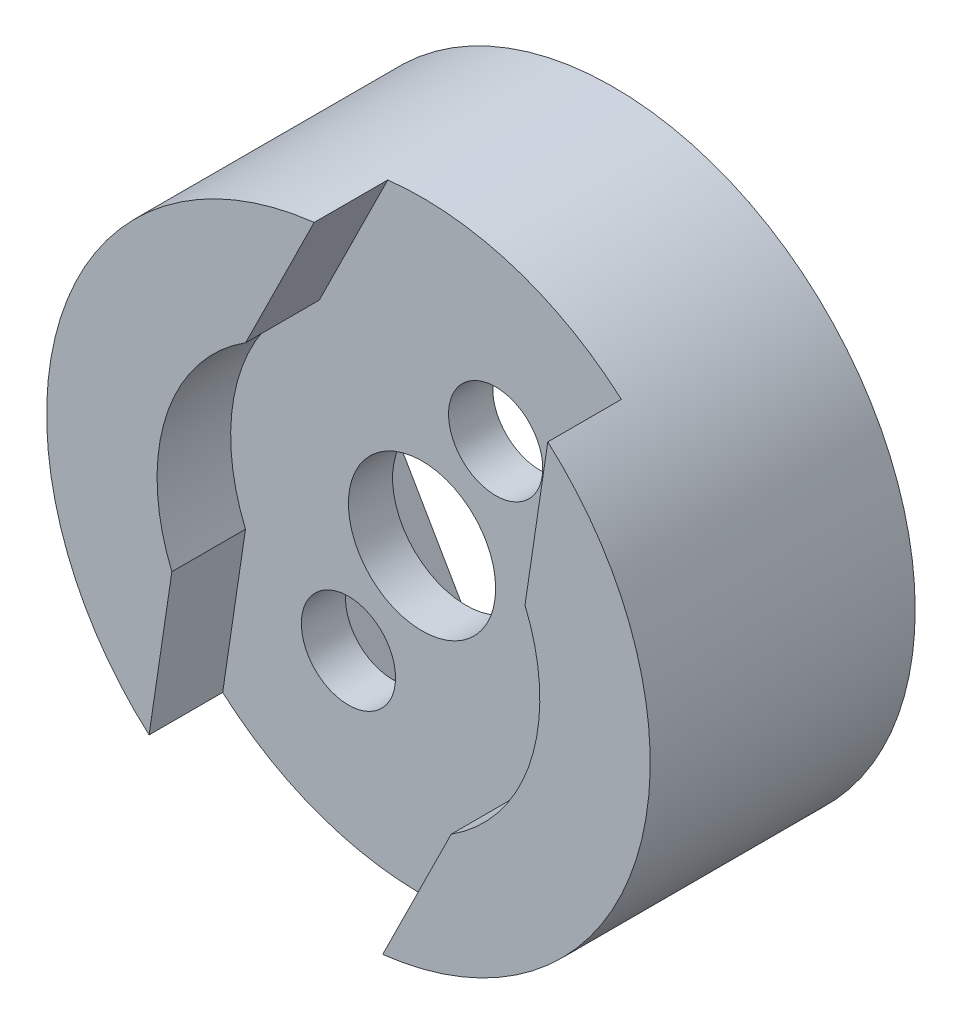
from build123d import *

# Parameters (mm, degrees)
SKETCH1_R               = 10.25
BOSS_EXTRUDE1_DEPTH     = 5
SKETCH2_R               = 10.25
BOSS_EXTRUDE2_DEPTH     = 4
CUT_EXTRUDE1_DEPTH      = 18.062385531
CUT_EXTRUDE1_DEPTH_BACK = 2.5
CUT_EXTRUDE2_DEPTH      = 16.333786225
CUT_EXTRUDE2_DEPTH_BACK = 16.333786225
SKETCH4_R               = 1.6
CUT_EXTRUDE3_DEPTH      = 16.333786225
CUT_EXTRUDE3_DEPTH_BACK = 16.333786225
SKETCH5_R               = 2.5


with BuildPart() as part:
    # Sketch1 → Boss-Extrude1 (new body)
    with BuildSketch(Plane.XY):
        Circle(SKETCH1_R)
        Polygon((4.75, 8.227241336), (-4.75, 8.227241336), (-9.5, 0), (-4.75, -8.227241336), (4.75, -8.227241336), (9.5, 0), align=None, mode=Mode.SUBTRACT)
    extrude(amount=BOSS_EXTRUDE1_DEPTH)

    # Sketch2 → Boss-Extrude2 (add)
    with BuildSketch(Plane.XY.offset(5)):
        Circle(SKETCH2_R)
    extrude(amount=BOSS_EXTRUDE2_DEPTH)

    # Sketch3 → Cut-Extrude1 (cut, two sides: drawn at the far end of the back side and taken through both)
    with BuildSketch(Plane.XY.offset(9).offset(-CUT_EXTRUDE1_DEPTH_BACK)):
        with BuildLine():
            ThreePointArc((-3.491027293, 5.482948882), (-6.202138006, 1.94511803), (-5.996942005, -2.507326583))
            Line((-5.996942005, -2.507326583), (-6.770608941, -7.695541213))
            ThreePointArc((-6.770608941, -7.695541213), (-3.067301509, -9.780294548), (1.163287858, -10.183774416))
            Line((1.163287858, -10.183774416), (3.491027293, -5.482948882))
            ThreePointArc((3.491027293, -5.482948882), (6.202138006, -1.94511803), (5.996942005, 2.507326583))
            Line((5.996942005, 2.507326583), (6.770608941, 7.695541213))
            ThreePointArc((6.770608941, 7.695541213), (6.548360484, 7.885523126), (6.32078374, 8.069088728))
            ThreePointArc((6.32078374, 8.069088728), (2.787097923, 9.86380176), (-1.163287858, 10.183774416))
            Line((-1.163287858, 10.183774416), (-3.491027293, 5.482948882))
        make_face()
    extrude(amount=CUT_EXTRUDE1_DEPTH + CUT_EXTRUDE1_DEPTH_BACK, mode=Mode.SUBTRACT)

    # Sketch4 → Cut-Extrude2 (cut, two sides: drawn at the far end of the back side and taken through both)
    with BuildSketch(Plane(origin=(0, 0, 5), x_dir=(-1, 0, 0), z_dir=(0, 0, -1)).offset(-CUT_EXTRUDE2_DEPTH_BACK)):
        with Locations(Location((2.5, -4.330127019, 0), (0, 0, 180))):
            Circle(SKETCH4_R)
        with Locations(Location((-2.5, 4.330127019, 0), (0, 0, 180))):
            Circle(SKETCH4_R)
    extrude(amount=CUT_EXTRUDE2_DEPTH + CUT_EXTRUDE2_DEPTH_BACK, mode=Mode.SUBTRACT)

    # Sketch5 → Cut-Extrude3 (cut, two sides: drawn at the far end of the back side and taken through both)
    with BuildSketch(Plane(origin=(0, 0, 5), x_dir=(-1, 0, 0), z_dir=(0, 0, -1)).offset(-CUT_EXTRUDE3_DEPTH_BACK)):
        with Locations(Location((0, 0, 0), (0, 0, 180))):
            Circle(SKETCH5_R)
    extrude(amount=CUT_EXTRUDE3_DEPTH + CUT_EXTRUDE3_DEPTH_BACK, mode=Mode.SUBTRACT)


solid = part.part
